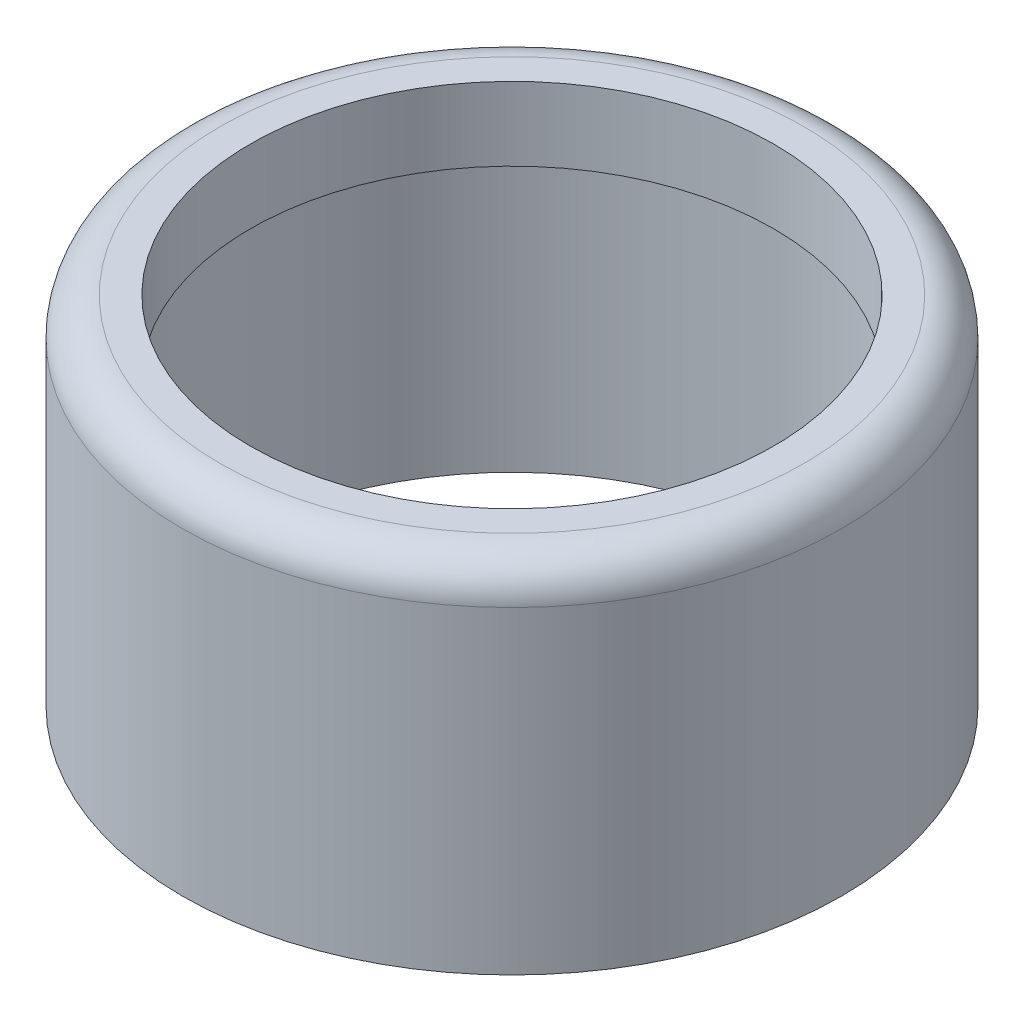
from build123d import *


with BuildPart() as part:
    # Sketch1 → Revolve1 (revolve)
    with BuildSketch(Plane.XY, mode=Mode.PRIVATE) as revolve1_sk:
        with BuildLine():
            Line((15.2, -19.862439096), (15.2, -4.862439096))
            Line((15.2, -4.862439096), (13.9, -4.862439096))
            Line((13.9, -4.862439096), (13.9, -0.962439096))
            Line((13.9, -0.962439096), (15.5, -0.962439096))
            ThreePointArc((15.5, -0.962439096), (16.914213562, -1.548225533), (17.5, -2.962439096))
            Line((17.5, -2.962439096), (17.5, -19.862439096))
            Line((17.5, -19.862439096), (15.2, -19.862439096))
        make_face()
    revolve(revolve1_sk.sketch.rotate(Axis((0, 0, 0), (0, -1, 0)), 90), axis=Axis((0, 0, 0), (0, -1, 0)))


solid = part.part
